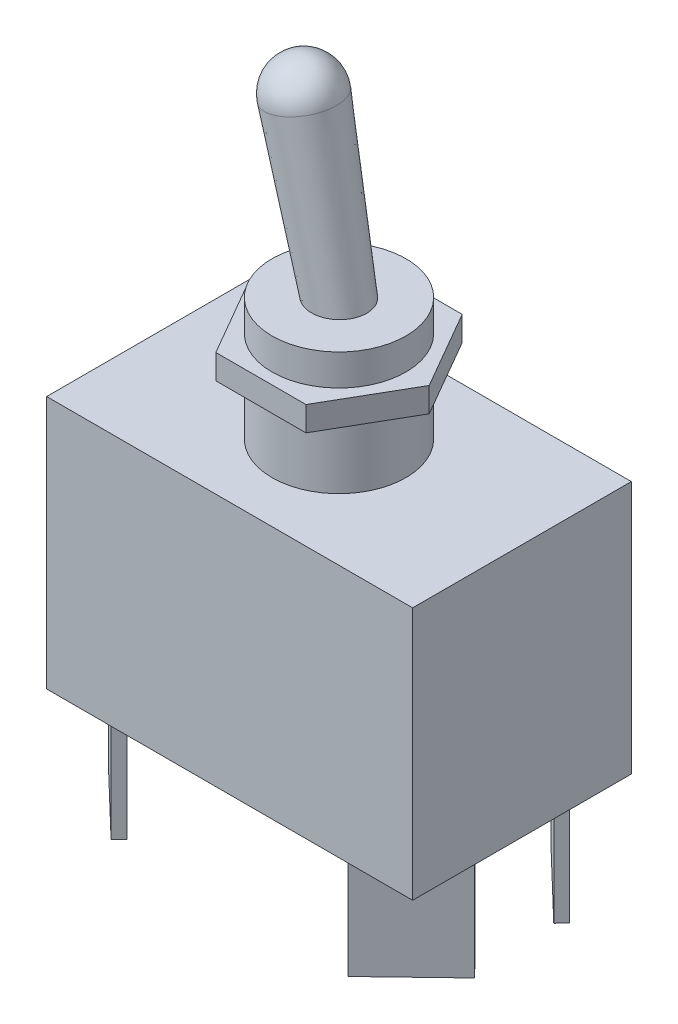
from build123d import *

# Parameters (mm, degrees)
ESQUISSE1_W        = 32.8
ESQUISSE1_H        = 19.6
BOSS_EXTRU_1_DEPTH = 22.7
ESQUISSE2_R        = 6
BOSS_EXTRU_2_DEPTH = 11
BOSS_EXTRU_3_DEPTH = 8.8
BOSS_EXTRU_4_START = 6
BOSS_EXTRU_4_DEPTH = 2.2


with BuildPart() as part:
    # Esquisse1 → Boss.-Extru.1 (new body)
    with BuildSketch(Plane(origin=(0, 0, 0), x_dir=(1, 0, 0), z_dir=(0, 1, 0))):
        Rectangle(ESQUISSE1_W, ESQUISSE1_H)
    extrude(amount=BOSS_EXTRU_1_DEPTH)

    # Esquisse2 → Boss.-Extru.2 (add)
    with BuildSketch(Plane(origin=(0, 22.7, 0), x_dir=(1, 0, 0), z_dir=(0, 1, 0))):
        with Locations(Location((0, 0, 0), (0, 0, 270))):
            Circle(ESQUISSE2_R)
    extrude(amount=BOSS_EXTRU_2_DEPTH)

    # Esquisse4 → Boss.-Extru.3 (add)
    with BuildSketch(Plane.XZ):
        Polygon((-16.4, 4.262076942), (-10.626664032, 9.8), (-9.93442365, 9.078333004), (-15.707759618, 3.540409946), align=None)
        Polygon((15.707759618, 3.540409946), (16.4, 4.262076942), (10.626664032, 9.8), (9.93442365, 9.078333004), align=None)
        Polygon((16.4, -4.262076942), (10.626664032, -9.8), (9.93442365, -9.078333004), (15.707759618, -3.540409946), align=None)
        Polygon((-15.707759618, -3.540409946), (-16.4, -4.262076942), (-10.626664032, -9.8), (-9.93442365, -9.078333004), align=None)
    extrude(amount=BOSS_EXTRU_3_DEPTH)


with BuildPart() as body_2:
    # Esquisse3 → Révolution1 (revolve)
    with BuildSketch(Plane.XY, mode=Mode.PRIVATE) as r_volution1_sk:
        with BuildLine():
            Line((0, 33.7), (-3.809337205, 50.882809725))
            ThreePointArc((-3.809337205, 50.882809725), (-5.722131309, 49.515864065), (-6.063443101, 47.189745413))
            Line((-6.063443101, 47.189745413), (-2.102430111, 32.094906225))
            Line((-2.102430111, 32.094906225), (0, 33.7))
        make_face()
    revolve(r_volution1_sk.sketch.rotate(Axis((0, 33.7, 0), (-0.21643961393810363, 0.9762960071199333, 0)), 180), axis=Axis((0, 33.7, 0), (-0.21643961393810363, 0.9762960071199333, 0)))


with BuildPart() as body_3:
    # Esquisse5 → Boss.-Extru.4 (new body)
    with BuildSketch(Plane(origin=(0, 22.7, 0), x_dir=(1, 0, 0), z_dir=(0, 1, 0)).offset(BOSS_EXTRU_4_START)):
        Polygon((8.082903769, 0), (4.041451884, 7), (-4.041451884, 7), (-8.082903769, 0), (-4.041451884, -7), (4.041451884, -7), align=None)
    extrude(amount=BOSS_EXTRU_4_DEPTH)


solid = Compound([part.part, body_2.part, body_3.part])
